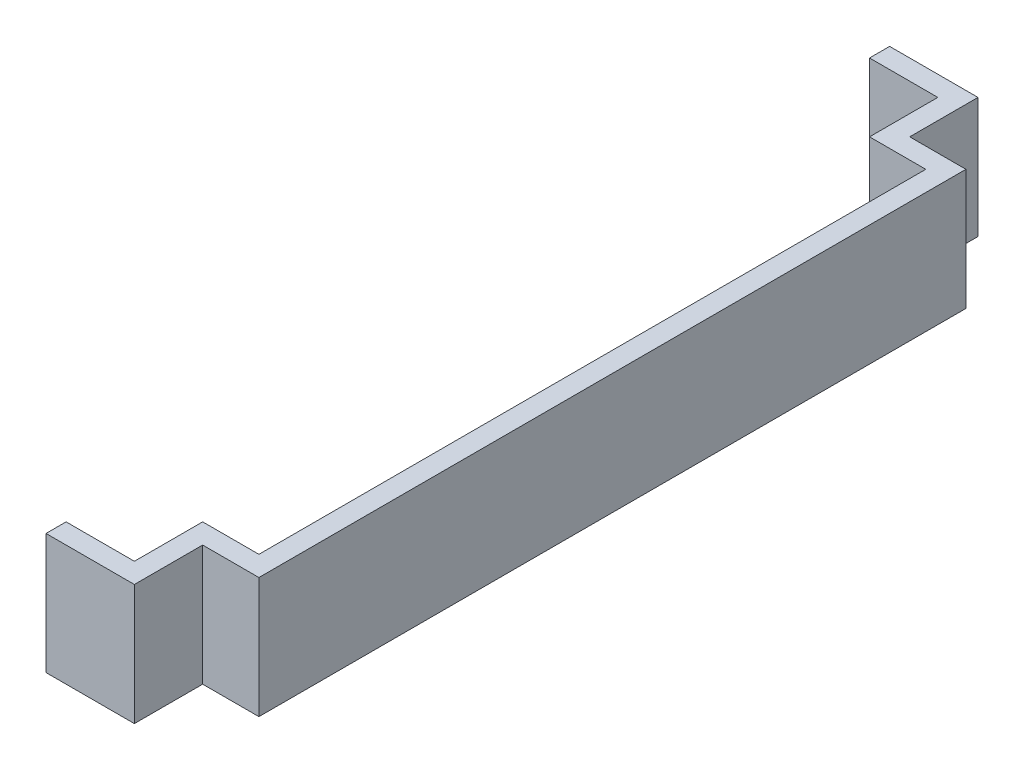
from build123d import *

# Parameters (mm, degrees)
BOSS_EXTRUDE1_DEPTH = 15


with BuildPart() as part:
    # Sketch1 → Boss-Extrude1 (new body)
    with BuildSketch(Plane(origin=(0, 0, 0), x_dir=(1, 0, 0), z_dir=(0, 1, 0))):
        Polygon((2.5, 44), (2.5, -44), (-4.5, -44), (-4.5, -52.5), (-15.5, -52.5), (-15.5, -50), (-7, -50), (-7, -41.5), (0, -41.5), (0, 41.5), (-7, 41.5), (-7, 50), (-15.5, 50), (-15.5, 52.5), (-4.5, 52.5), (-4.5, 44), align=None)
    extrude(amount=BOSS_EXTRUDE1_DEPTH)


solid = part.part
